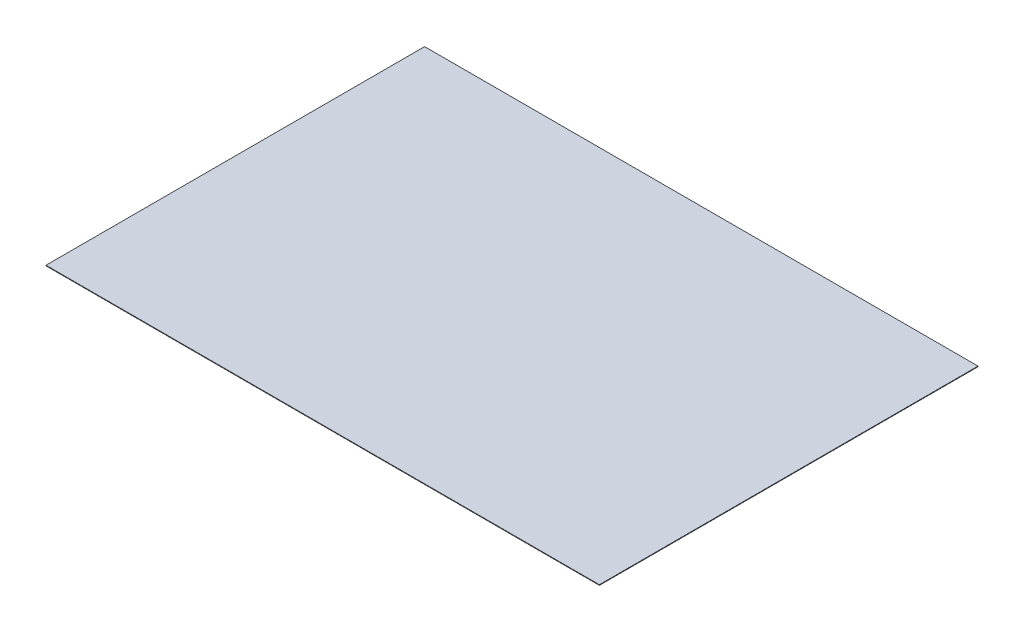
from build123d import *

# Parameters (mm, degrees)
SKIZZE1_W                       = 95
SKIZZE1_H                       = 65
AUFSATZ_LINEAR_AUSTRAGEN1_DEPTH = 0.1


with BuildPart() as part:
    # Skizze1 → Aufsatz-Linear austragen1 (new body)
    with BuildSketch(Plane(origin=(0, 0, 0), x_dir=(1, 0, 0), z_dir=(0, 1, 0))):
        with Locations((47.5, 32.5)):
            Rectangle(SKIZZE1_W, SKIZZE1_H)
    extrude(amount=AUFSATZ_LINEAR_AUSTRAGEN1_DEPTH)


solid = part.part
